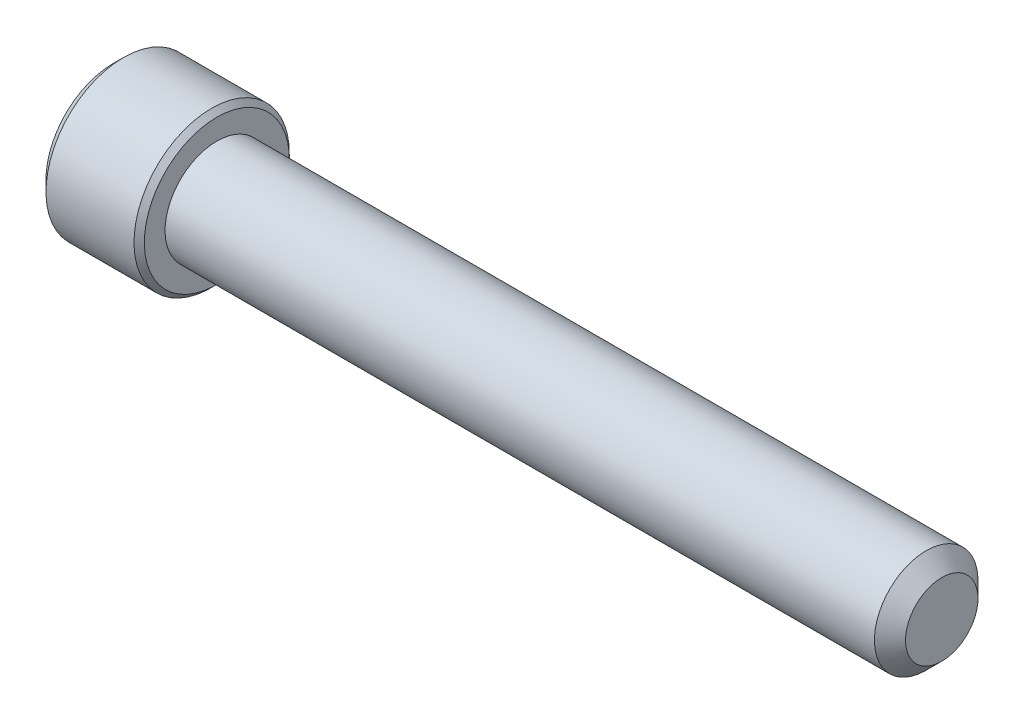
from build123d import *

# Parameters (mm, degrees)
SKETCH2_R           = 3.175
BOSS_EXTRUDE1_DEPTH = 44.45
CHAMFER1_SIZE       = 0.9525
CUT_EXTRUDE1_DEPTH  = 3.048
SKETCH8_R           = 2.749630657
CUT_EXTRUDE2_DEPTH  = 1.27
CUT_EXTRUDE2_DRAFT  = -45


with BuildPart() as part:
    # Sketch2 → Boss-Extrude1 (new body)
    with BuildSketch(Plane(origin=(22.225, 0, 0), x_dir=(0, 0, -1), z_dir=(1, 0, 0))):
        Circle(SKETCH2_R)
    extrude(amount=-BOSS_EXTRUDE1_DEPTH)

    # Chamfer1
    chamfer1_edges = [part.edges().sort_by_distance(p)[0] for p in [
        (22.225, 0, 3.175),
    ]]
    chamfer(chamfer1_edges, length=CHAMFER1_SIZE)

    # Sketch6 → Revolve1 (revolve)
    with BuildSketch(Plane.XY):
        Polygon((-27.94, 4.7625), (-28.575, 4.1275), (-28.575, 0), (-22.225, 0), (-22.225, 4.445), (-22.5425, 4.7625), align=None)
    revolve(axis=Axis((-22.225, 0, 0), (-1, 0, 0)))

    # Sketch4 → Cut-Extrude1 (cut)
    with BuildSketch(Plane(origin=(-28.575, 0, 0), x_dir=(0, 0, -1), z_dir=(1, 0, 0))):
        Polygon((0, 2.749630657), (-2.38125, 1.374815329), (-2.38125, -1.374815329), (0, -2.749630657), (2.38125, -1.374815329), (2.38125, 1.374815329), align=None)
    extrude(amount=CUT_EXTRUDE1_DEPTH, mode=Mode.SUBTRACT)


with BuildPart() as cut_extrude2_tool:
    # Sketch8 → Cut-Extrude2 (with draft: the straight prism first)
    with BuildSketch(Plane.ZY.offset(28.575)):
        Circle(SKETCH8_R)
    extrude(amount=-CUT_EXTRUDE2_DEPTH)
    # Cut-Extrude2: the draft: its side faces are tilted about the plane it starts from
    cut_extrude2_sides = [cut_extrude2_tool.faces().sort_by_distance(p)[0] for p in [
        (-27.94, 0, -2.749630657),
    ]]
    draft(cut_extrude2_sides, Plane.ZY.offset(28.575), CUT_EXTRUDE2_DRAFT)


with BuildPart() as part_1:
    add(part.part)

    # Cut-Extrude2: cut by cut_extrude2_tool
    add(cut_extrude2_tool.part, mode=Mode.SUBTRACT)


solid = part_1.part
